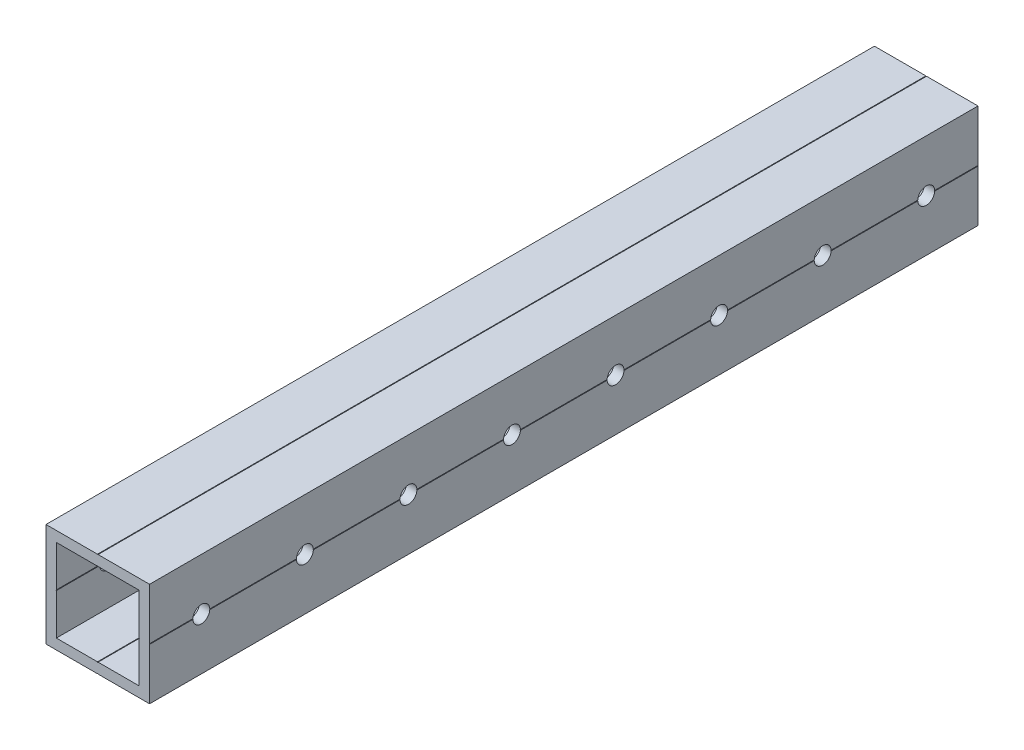
from build123d import *

# Parameters (mm, degrees)
SKETCH1_W                 = 25.4
SKETCH1_H                 = 1498.6
BOSS_EXTRUDE1_DEPTH       = 25.4
CUT_EXTRUDE1_DEPTH        = 1499.707623254
CUT_EXTRUDE2_DEPTH        = 1498.6
CUT_EXTRUDE3_DEPTH        = 1499.707623254
CUT_EXTRUDE4_DEPTH        = 1499.707623254
CUT_EXTRUDE5_DEPTH        = 1499.707623254
DRAFT1_ANGLE              = 45
DRAFT2_ANGLE              = 45
DRAFT3_ANGLE              = 45
DRAFT4_ANGLE              = 45
DRAFT5_ANGLE              = 45
DRAFT6_ANGLE              = 45
DRAFT7_ANGLE              = 45
DRAFT8_ANGLE              = 45
F_6_CLEARANCE_HOLE1_D     = 4.1402
F_6_CLEARANCE_HOLE1_DEPTH = 25.4
CUT_EXTRUDE6_DEPTH        = 27.94
CUT_EXTRUDE6_DEPTH_BACK   = 27.94
SKETCH9_W                 = 1349.505719756
SKETCH9_H                 = 328.538757318
CUT_EXTRUDE7_DEPTH        = 27.94
CUT_EXTRUDE7_DEPTH_BACK   = 27.94
SKETCH10_W                = 219.492991325
SKETCH10_H                = 183.319565381


with BuildPart() as part:
    # Sketch1 → Boss-Extrude1 (new body)
    with BuildSketch(Plane.XZ.offset(12.7)):
        Rectangle(SKETCH1_W, SKETCH1_H)
    extrude(amount=-BOSS_EXTRUDE1_DEPTH)

    # Sketch2 → Cut-Extrude1 (cut, through all)
    with BuildSketch(Plane.XY.offset(749.3)):
        Polygon((0.0762, 12.7), (-0.0762, 12.7), (0.0762, 12.5476), align=None)
    extrude(amount=-CUT_EXTRUDE1_DEPTH, mode=Mode.SUBTRACT)

    # Sketch3 → Cut-Extrude2 (cut)
    with BuildSketch(Plane.XY.offset(749.3)):
        Polygon((12.7, 0.0762), (12.5476, -0.0762), (12.7, -0.0762), align=None)
    extrude(amount=-CUT_EXTRUDE2_DEPTH, mode=Mode.SUBTRACT)

    # Sketch4 → Cut-Extrude3 (cut, through all)
    with BuildSketch(Plane.XY.offset(749.3)):
        Polygon((-0.0762, -12.7), (0.0762, -12.7), (-0.0762, -12.5476), align=None)
    extrude(amount=-CUT_EXTRUDE3_DEPTH, mode=Mode.SUBTRACT)

    # Sketch5 → Cut-Extrude4 (cut, through all)
    with BuildSketch(Plane.XY.offset(749.3)):
        Polygon((-12.7, -0.0762), (-12.5476, -0.0762), (-12.7, 0.0762), align=None)
    extrude(amount=-CUT_EXTRUDE4_DEPTH, mode=Mode.SUBTRACT)

    # Sketch6 → Cut-Extrude5 (cut, through all)
    with BuildSketch(Plane.XY.offset(749.3)):
        Polygon((-10.16, -10.16), (-0.0762, -10.16), (0.0762, -10.3124), (0.0762, -10.16), (10.16, -10.16), (10.16, -0.0762), (10.3124, 0.0762), (10.16, 0.0762), (10.16, 10.16), (0.0762, 10.16), (-0.0762, 10.3124), (-0.0762, 10.16), (-10.16, 10.16), (-10.16, 0.0762), (-10.3124, 0.0762), (-10.16, -0.0762), align=None)
    extrude(amount=-CUT_EXTRUDE5_DEPTH, mode=Mode.SUBTRACT)

    # Draft1
    draft1_faces = [part.faces().sort_by_distance(p)[0] for p in [
        (0.0762, 12.6238, 0),
    ]]
    draft(draft1_faces, Plane.ZX.offset(12.7), DRAFT1_ANGLE)

    # Draft2
    draft2_faces = [part.faces().sort_by_distance(p)[0] for p in [
        (12.6238, -0.0762, 0),
    ]]
    draft(draft2_faces, Plane(origin=(12.7, 12.7, -749.3), x_dir=(0, 0, 1), z_dir=(1, 0, 0)), DRAFT2_ANGLE)

    # Draft3
    draft3_faces = [part.faces().sort_by_distance(p)[0] for p in [
        (-0.0762, -12.6238, 0),
    ]]
    draft(draft3_faces, Plane(origin=(0, -12.7, 0), x_dir=(0, 0, -1), z_dir=(0, -1, 0)), DRAFT3_ANGLE)

    # Draft4
    draft4_faces = [part.faces().sort_by_distance(p)[0] for p in [
        (-12.6238, -0.0762, 0),
    ]]
    draft(draft4_faces, Plane(origin=(-12.7, 12.7, 749.3), x_dir=(0, 0, -1), z_dir=(-1, 0, 0)), DRAFT4_ANGLE)

    # Draft5
    draft5_faces = [part.faces().sort_by_distance(p)[0] for p in [
        (0.0762, -10.2362, 0),
    ]]
    draft(draft5_faces, Plane(origin=(0.0762, -10.16, -749.3), x_dir=(0, 0, 1), z_dir=(0, 1, 0)), DRAFT5_ANGLE)

    # Draft6
    draft6_faces = [part.faces().sort_by_distance(p)[0] for p in [
        (10.2362, 0.0762, 0),
    ]]
    draft(draft6_faces, Plane(origin=(10.16, 0.0762, -749.3), x_dir=(0, 0, -1), z_dir=(-1, 0, 0)), DRAFT6_ANGLE)

    # Draft7
    draft7_faces = [part.faces().sort_by_distance(p)[0] for p in [
        (-0.0762, 10.2362, 0),
    ]]
    draft(draft7_faces, Plane(origin=(-0.0762, 10.16, -749.3), x_dir=(0, 0, -1), z_dir=(0, -1, 0)), DRAFT7_ANGLE)

    # Draft8
    draft8_faces = [part.faces().sort_by_distance(p)[0] for p in [
        (-10.2362, 0.0762, 0),
    ]]
    draft(draft8_faces, Plane(origin=(-10.16, 10.16, -749.3), x_dir=(0, 0, 1), z_dir=(1, 0, 0)), DRAFT8_ANGLE)

    # #6 Clearance Hole1
    with Locations(Plane(origin=(12.7, 0, 0), x_dir=(0, 0, -1), z_dir=(1, 0, 0))):
        with Locations((736.370373577, 0.659511802), (711.2, 0), (685.8, 0), (660.4, 0), (635, 0), (609.6, 0), (584.2, 0), (558.8, 0), (533.4, 0), (508, 0), (482.6, 0), (457.2, 0), (431.8, 0), (406.4, 0), (381, 0), (355.6, 0), (330.2, 0), (304.8, 0), (279.4, 0), (254, 0), (228.6, 0), (203.2, 0), (177.8, 0), (152.4, 0), (127, 0), (101.6, 0), (76.2, 0), (50.8, 0), (25.4, 0), (0, 0), (-25.4, 0), (-50.8, 0), (-76.2, 0), (-101.6, 0), (-127, 0), (-152.4, 0), (-177.8, 0), (-203.2, 0), (-228.6, 0), (-254, 0), (-279.4, 0), (-304.8, 0), (-330.2, 0), (-355.6, 0), (-381, 0), (-406.4, 0), (-431.8, 0), (-457.2, 0), (-482.6, 0), (-508, 0), (-533.4, 0), (-558.8, 0), (-584.2, 0), (-609.6, 0), (-635, 0), (-660.4, 0), (-685.8, 0), (-711.2, 0), (-736.6, 0)):
            Hole(F_6_CLEARANCE_HOLE1_D / 2, depth=F_6_CLEARANCE_HOLE1_DEPTH)

    # Sketch9 → Cut-Extrude6 (cut, two sides: drawn at the far end of the back side and taken through both)
    with BuildSketch(Plane(origin=(0, 0, 0), x_dir=(0, 0, -1), z_dir=(1, 0, 0)).offset(-CUT_EXTRUDE6_DEPTH_BACK)):
        with Locations((154.052859878, 16.138073624)):
            Rectangle(SKETCH9_W, SKETCH9_H)
    extrude(amount=CUT_EXTRUDE6_DEPTH + CUT_EXTRUDE6_DEPTH_BACK, mode=Mode.SUBTRACT)

    # Sketch10 → Cut-Extrude7 (cut, two sides: drawn at the far end of the back side and taken through both)
    with BuildSketch(Plane(origin=(0, 0, 0), x_dir=(0, 0, -1), z_dir=(1, 0, 0)).offset(-CUT_EXTRUDE7_DEPTH_BACK)):
        with Locations((-436.353504337, -31.575109087)):
            Rectangle(SKETCH10_W, SKETCH10_H)
    extrude(amount=CUT_EXTRUDE7_DEPTH + CUT_EXTRUDE7_DEPTH_BACK, mode=Mode.SUBTRACT)


solid = part.part
